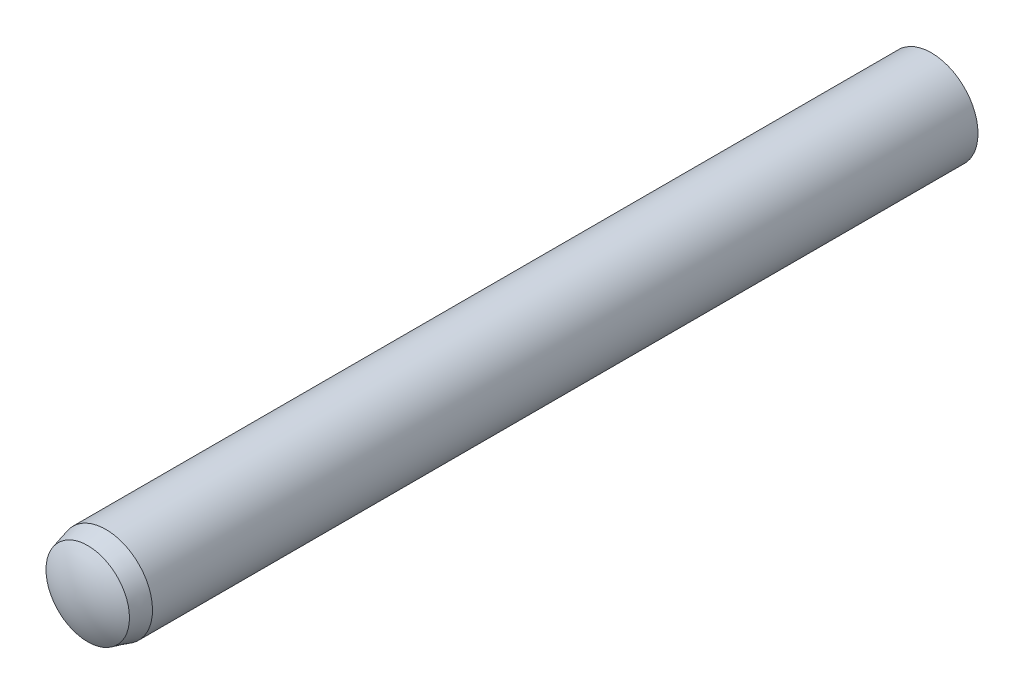
from build123d import *


with BuildPart() as part:
    # Sketch3 → Revolve1 (revolve)
    with BuildSketch(Plane(origin=(0, 0, 0), x_dir=(0, 0, -1), z_dir=(1, 0, 0))):
        with BuildLine():
            Line((-14, 0), (14, 0))
            ThreePointArc((14, 0), (13.885076627, 0.783022988), (13.55, 1.5))
            Line((13.55, 1.5), (-13.025, 1.5))
            Line((-13.025, 1.5), (-13.61, 1.343249722))
            ThreePointArc((-13.61, 1.343249722), (-13.90052754, 0.699360389), (-14, 0))
        make_face()
    revolve(axis=Axis((0, 0, 14), (0, 0, -1)))


solid = part.part
